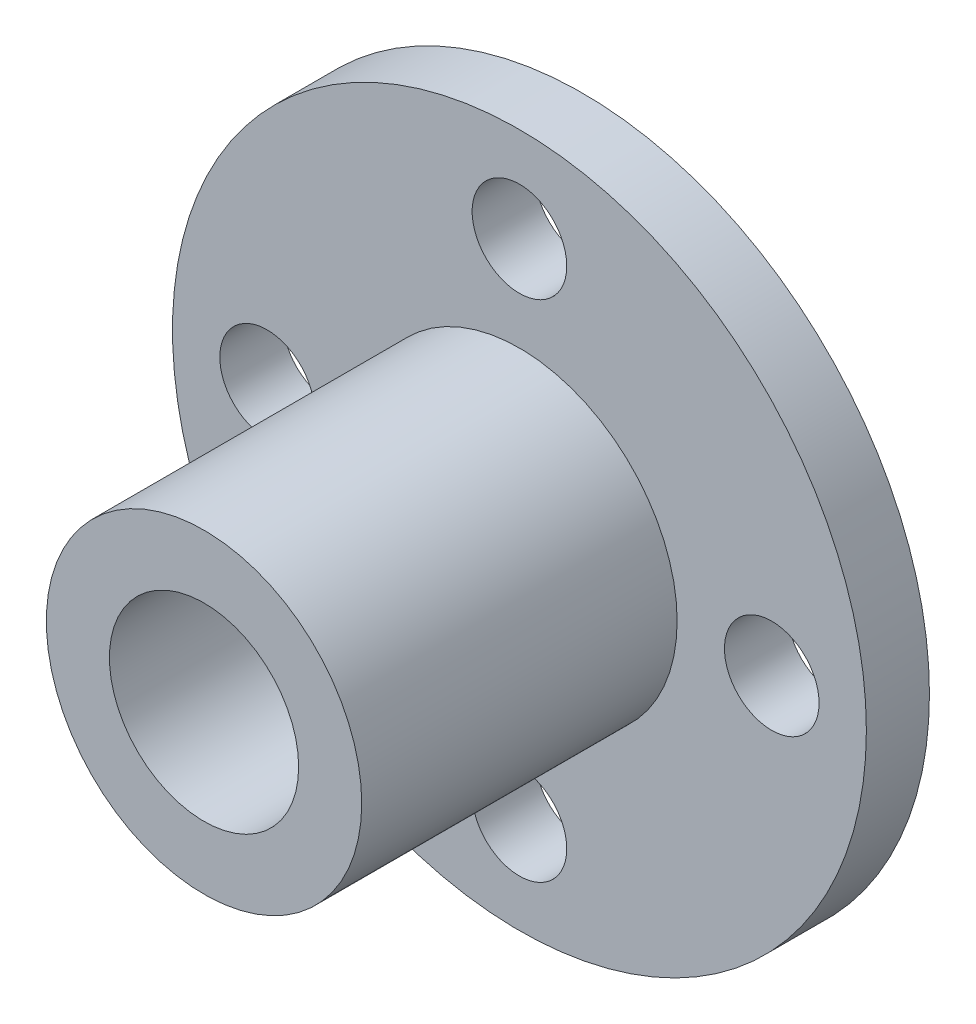
from build123d import *

# Parameters (mm, degrees)
SKETCH_1_R          = 11
SKETCH_1_R_2        = 1.5
EXTRUDE_1_DEPTH     = 2
SKETCH_2_R          = 5
SKETCH_2_R_2        = 3
EXTRUDE_2_DEPTH     = 10
SKETCH_2_2_R        = 3
CUT_EXTRUDE_1_DEPTH = 19.493242009


with BuildPart() as part:
    # 스케치1 → 보스-돌출1 (new body)
    with BuildSketch(Plane.XY):
        Circle(SKETCH_1_R)
        with Locations((0, 8)):
            Circle(SKETCH_1_R_2, mode=Mode.SUBTRACT)
        with Locations((8, 0)):
            Circle(SKETCH_1_R_2, mode=Mode.SUBTRACT)
        with Locations((0, -8)):
            Circle(SKETCH_1_R_2, mode=Mode.SUBTRACT)
        with Locations((-8, 0)):
            Circle(SKETCH_1_R_2, mode=Mode.SUBTRACT)
    extrude(amount=EXTRUDE_1_DEPTH)

    # 스케치2 → 보스-돌출2 (add)
    with BuildSketch(Plane.XY.offset(2)):
        Circle(SKETCH_2_R)
        Circle(SKETCH_2_R_2, mode=Mode.SUBTRACT)
    extrude(amount=EXTRUDE_2_DEPTH)

    # 스케치2<2> → 컷-돌출1 (cut, through all)
    with BuildSketch(Plane.XY.offset(2)):
        Circle(SKETCH_2_2_R)
    extrude(amount=-CUT_EXTRUDE_1_DEPTH, mode=Mode.SUBTRACT)


solid = part.part
